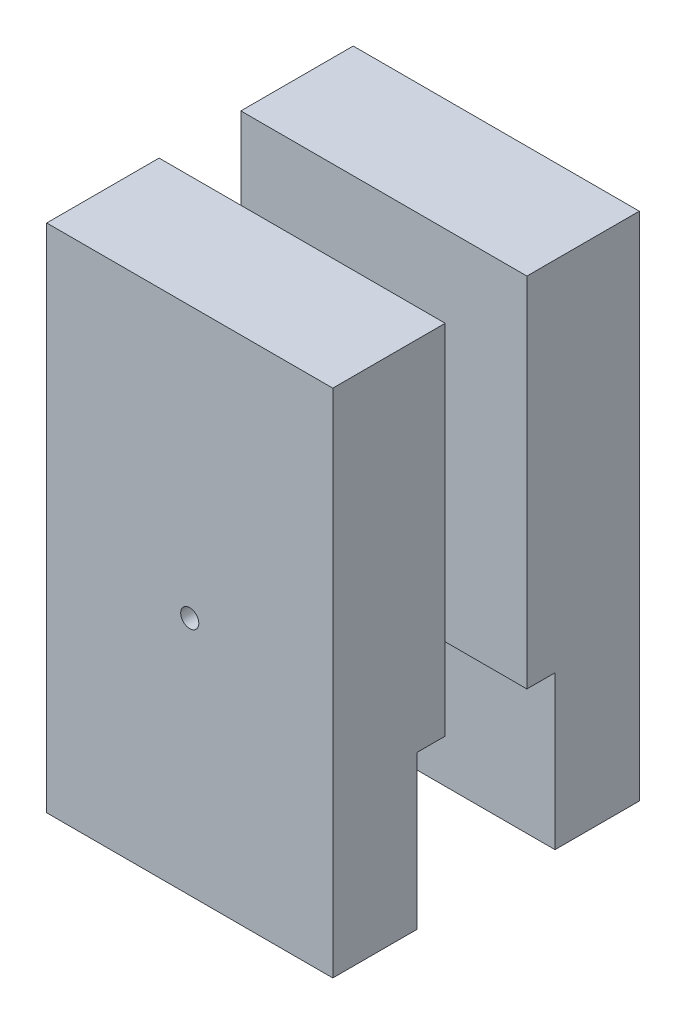
from build123d import *

# Parameters (mm, degrees)
SKETCH1_W               = 35.56
SKETCH1_H               = 38.1
BOSS_EXTRUDE1_DEPTH     = 63.5
SKETCH3_W               = 35.56
SKETCH3_H               = 10.16
CUT_EXTRUDE1_DEPTH      = 38.1
SKETCH4_W               = 35.56
SKETCH4_H               = 17.145
CUT_EXTRUDE2_DEPTH      = 19.05
SKETCH5_W               = 17.145
SKETCH5_H               = 10.16
CUT_EXTRUDE3_DEPTH      = 47.158865887
CUT_EXTRUDE4_DEPTH      = 71.21848261
CUT_EXTRUDE4_DEPTH_BACK = 71.21848261
SKETCH6_R               = 1.125


with BuildPart() as part:
    # Sketch1 → Boss-Extrude1 (new body)
    with BuildSketch(Plane(origin=(0, 0, 0), x_dir=(1, 0, 0), z_dir=(0, 1, 0))):
        Rectangle(SKETCH1_W, SKETCH1_H)
    extrude(amount=BOSS_EXTRUDE1_DEPTH)

    # Sketch3 → Cut-Extrude1 (cut)
    with BuildSketch(Plane(origin=(0, 63.5, 0), x_dir=(1, 0, 0), z_dir=(0, 1, 0))):
        Rectangle(SKETCH3_W, SKETCH3_H)
    extrude(amount=-CUT_EXTRUDE1_DEPTH, mode=Mode.SUBTRACT)

    # Sketch4 → Cut-Extrude2 (cut)
    with BuildSketch(Plane.XZ):
        Rectangle(SKETCH4_W, SKETCH4_H)
    extrude(amount=-CUT_EXTRUDE2_DEPTH, mode=Mode.SUBTRACT)

    # Sketch5 → Cut-Extrude3 (cut, through all)
    with BuildSketch(Plane(origin=(0, 25.4, 0), x_dir=(1, 0, 0), z_dir=(0, 1, 0))):
        with Locations((-9.2075, 0)):
            Rectangle(SKETCH5_W, SKETCH5_H)
        with Locations((9.2075, 0)):
            Rectangle(SKETCH5_W, SKETCH5_H)
    extrude(amount=-CUT_EXTRUDE3_DEPTH, mode=Mode.SUBTRACT)

    # Sketch6 → Cut-Extrude4 (cut, two sides: drawn at the far end of the back side and taken through both)
    with BuildSketch(Plane.XY.offset(-5.08).offset(-CUT_EXTRUDE4_DEPTH_BACK)):
        with Locations((0, 29.845)):
            Circle(SKETCH6_R)
    extrude(amount=CUT_EXTRUDE4_DEPTH + CUT_EXTRUDE4_DEPTH_BACK, mode=Mode.SUBTRACT)


solid = part.part
